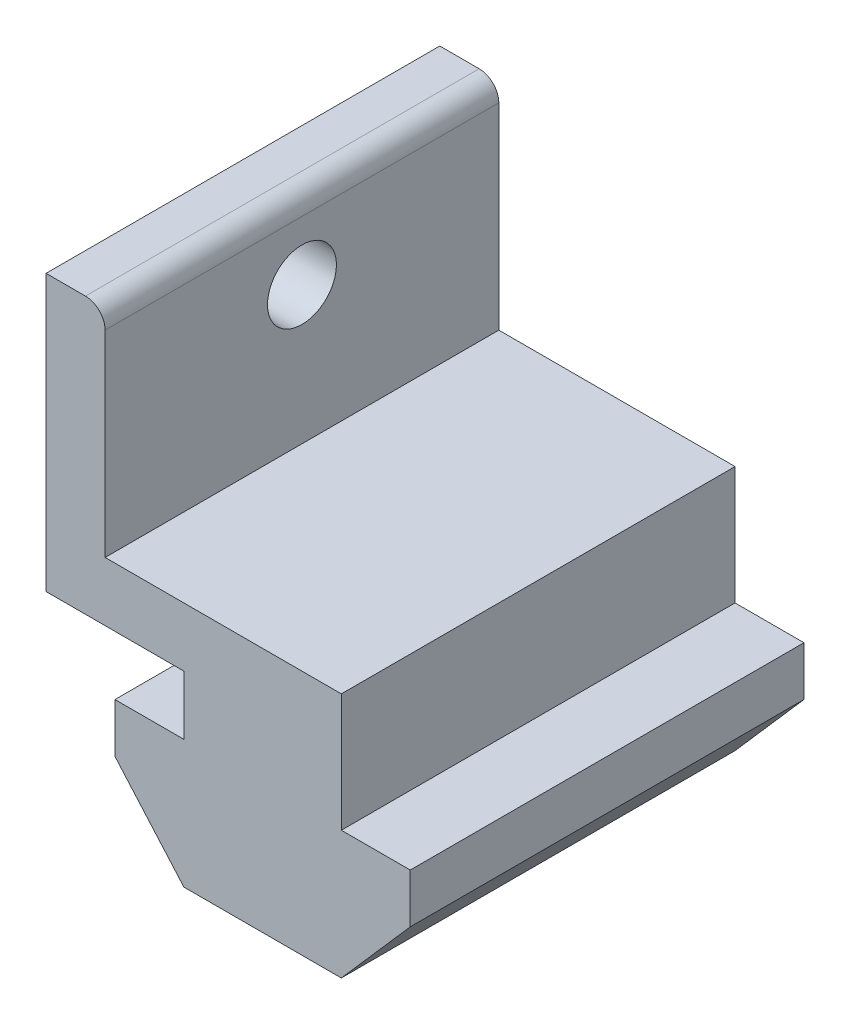
from build123d import *

# Parameters (mm, degrees)
ESTRUSIONE_ESTRUSIONE1_DEPTH = 20
TAGLIO_ESTRUSIONE1_REACH     = 37.979
SCHIZZO6_R                   = 1.75
ESTRUSIONE_ESTRUSIONE4_DEPTH = 0.6


with BuildPart() as part:
    # Schizzo2 → Estrusione-Estrusione1 (new body)
    with BuildSketch(Plane.XY):
        with BuildLine():
            Line((-4, 9.5), (-11, 9.5))
            Line((-11, 9.5), (-11, 23.5))
            Line((-11, 23.5), (-9, 23.5))
            ThreePointArc((-9, 23.5), (-8.292893219, 23.207106781), (-8, 22.5))
            Line((-8, 22.5), (-8, 12.5))
            Line((-8, 12.5), (4, 12.5))
            Line((4, 12.5), (4, 9.5))
            Line((4, 9.5), (4, 6.5))
            Line((4, 6.5), (7.5, 6.5))
            Line((7.5, 6.5), (7.5, 4))
            Line((7.5, 4), (4, 0))
            Line((4, 0), (-4, 0))
            Line((-4, 0), (-7.5, 4))
            Line((-7.5, 4), (-7.5, 6.5))
            Line((-7.5, 6.5), (-4, 6.5))
            Line((-4, 6.5), (-4, 9.5))
        make_face()
    extrude(amount=-ESTRUSIONE_ESTRUSIONE1_DEPTH)

    # Schizzo6 → Taglio-Estrusione1 (cut, up to next)
    with BuildSketch(Plane.ZY.offset(11), mode=Mode.PRIVATE) as taglio_estrusione1_sk1:
        with Locations((-10, 19.5)):
            Circle(SCHIZZO6_R)
    taglio_estrusione1_tool1 = extrude(taglio_estrusione1_sk1.sketch, amount=-TAGLIO_ESTRUSIONE1_REACH, mode=Mode.PRIVATE) & part.part
    add(taglio_estrusione1_tool1.solids().sort_by_distance((-11, 19.5, -10))[0], mode=Mode.SUBTRACT)

    # Schizzo11 → Estrusione-Estrusione4 (add)
    with BuildSketch(Plane(origin=(0, 0, -20), x_dir=(-1, 0, 0), z_dir=(0, 0, -1))):
        with BuildLine():
            Line((-1.916666667, 6), (-2.5, 6))
            add(Edge.make_bspline(
                [(-2.5, 6), (-2.484196549, 6.065431756), (-2.453302094, 6.193345487), (-2.388863743, 6.376101829), (-2.318665127, 6.549045511), (-2.234371075, 6.708938219), (-2.142426246, 6.858993324), (-2.037084049, 6.995807413), (-1.923204564, 7.122860063), (-1.797243944, 7.235613218), (-1.665147858, 7.337714716), (-1.525054993, 7.424768393), (-1.379783905, 7.499656106), (-1.228328086, 7.561350822), (-1.070236625, 7.607826795), (-0.906938753, 7.641546577), (-0.738006538, 7.66344436), (-0.623332441, 7.665581492), (-0.565104167, 7.666666667)],
                knots=[0, 0, 0, 0, 1.162005537, 2.271625781, 3.343758855, 4.383309926, 5.390229558, 6.379919256, 7.361854164, 8.333198761, 9.295911338, 10.242430842, 11.177959212, 12.116337295, 13.062827104, 14.020064771, 14.994644689, 16, 16, 16, 16], degree=3))
            add(Edge.make_bspline(
                [(-0.565104167, 7.666666667), (-0.480264789, 7.664105239), (-0.312436625, 7.659038256), (-0.065876681, 7.612768588), (0.171887412, 7.539550485), (0.398253158, 7.438384992), (0.608515961, 7.313608553), (0.795597451, 7.165102613), (0.956961828, 6.995732482), (1.092337101, 6.80865772), (1.198333527, 6.608726059), (1.276493935, 6.402954339), (1.324077057, 6.191830678), (1.330243806, 6.049281445), (1.333333333, 5.977864583)],
                knots=[0, 0, 0, 0, 1.083050992, 2.142477498, 3.193116406, 4.255571735, 5.30263384, 6.308962982, 7.297363603, 8.282367274, 9.249857812, 10.179914175, 11.08814088, 12, 12, 12, 12], degree=3))
            add(Edge.make_bspline(
                [(1.333333333, 5.977864583), (1.331172379, 5.909137679), (1.326943725, 5.774649792), (1.291038272, 5.578309869), (1.230613784, 5.393261183), (1.146912796, 5.218724739), (1.038564203, 5.055807179), (0.907314909, 4.904141953), (0.752238537, 4.763056374), (0.634720509, 4.682234495), (0.57421875, 4.640625)],
                knots=[0, 0, 0, 0, 1.024540389, 2.004866551, 2.965041327, 3.920577974, 4.882998113, 5.874504559, 6.905732034, 8, 8, 8, 8], degree=3))
            add(Edge.make_bspline(
                [(0.57421875, 4.640625), (0.643363437, 4.607236967), (0.780359061, 4.541085617), (0.967095758, 4.411353496), (1.136611813, 4.261563137), (1.231147291, 4.144669639), (1.278645833, 4.0859375)],
                knots=[0, 0, 0, 0, 1.015518401, 2.012035669, 3.001164323, 4, 4, 4, 4], degree=3))
            add(Edge.make_bspline(
                [(1.278645833, 4.0859375), (1.309922612, 4.043115961), (1.37196399, 3.958174116), (1.448544267, 3.821606468), (1.518018337, 3.683525131), (1.572154458, 3.540229091), (1.614077354, 3.393379209), (1.644044271, 3.24272333), (1.662660533, 3.088138431), (1.665326558, 2.983558111), (1.666666667, 2.930989583)],
                knots=[0, 0, 0, 0, 1.025084078, 2.033381695, 3.024893161, 4.013698104, 4.991890475, 5.976764909, 6.982997093, 8, 8, 8, 8], degree=3))
            add(Edge.make_bspline(
                [(1.666666667, 2.930989583), (1.663333999, 2.83997153), (1.656684346, 2.658363755), (1.597248208, 2.390053558), (1.505109333, 2.127777625), (1.374260737, 1.876924352), (1.214792507, 1.64221793), (1.025071762, 1.43221907), (0.807254146, 1.251707377), (0.56432937, 1.100888382), (0.301140417, 0.980326526), (0.019642889, 0.896648418), (-0.276107211, 0.842148704), (-0.478920764, 0.836304519), (-0.58203125, 0.833333333)],
                knots=[0, 0, 0, 0, 0.955779014, 1.907060117, 2.875433937, 3.871313158, 4.872415639, 5.851225146, 6.836215519, 7.83643374, 8.849228613, 9.86973379, 10.916971861, 12, 12, 12, 12], degree=3))
            add(Edge.make_bspline(
                [(-0.58203125, 0.833333333), (-0.651524236, 0.834945729), (-0.78826326, 0.838118387), (-0.9892869, 0.859807218), (-1.181170056, 0.899420085), (-1.364172166, 0.952726223), (-1.538455805, 1.020310887), (-1.703489143, 1.104474184), (-1.860287517, 1.203481259), (-2.007371283, 1.318500779), (-2.144722909, 1.447166124), (-2.268692254, 1.591761428), (-2.381346155, 1.74961375), (-2.479668199, 1.922556569), (-2.568136825, 2.108354904), (-2.640901459, 2.309387829), (-2.704946086, 2.523858156), (-2.73472252, 2.673316816), (-2.75, 2.75)],
                knots=[0, 0, 0, 0, 1.048658725, 2.063410685, 3.046034179, 4.001477787, 4.936774919, 5.862367409, 6.792675028, 7.730719943, 8.675894397, 9.627829632, 10.600096036, 11.597688215, 12.626045268, 13.701542398, 14.82072376, 16, 16, 16, 16], degree=3))
            Line((-2.75, 2.75), (-2.166666667, 2.75))
            add(Edge.make_bspline(
                [(-2.166666667, 2.75), (-2.151469125, 2.699951833), (-2.121908588, 2.602603799), (-2.071590606, 2.462500375), (-2.014263815, 2.33406399), (-1.952765349, 2.216352478), (-1.888176806, 2.108206588), (-1.815906231, 2.012485974), (-1.74130639, 1.924986312), (-1.685073305, 1.875689176), (-1.657552083, 1.8515625)],
                knots=[0, 0, 0, 0, 1.198163088, 2.33053128, 3.407730985, 4.417276592, 5.372219308, 6.28897303, 7.162600585, 8, 8, 8, 8], degree=3))
            add(Edge.make_bspline(
                [(-1.657552083, 1.8515625), (-1.621158441, 1.823504166), (-1.548483496, 1.767474107), (-1.430056781, 1.695971082), (-1.305507707, 1.634014892), (-1.172137598, 1.586688029), (-1.032824452, 1.54661523), (-0.885316488, 1.520391409), (-0.730915085, 1.502399091), (-0.625489239, 1.500811361), (-0.571614583, 1.5)],
                knots=[0, 0, 0, 0, 0.946170439, 1.889420265, 2.845303464, 3.807233317, 4.801018734, 5.828864929, 6.890507805, 8, 8, 8, 8], degree=3))
            add(Edge.make_bspline(
                [(-0.571614583, 1.5), (-0.51078665, 1.501143824), (-0.391842877, 1.503380473), (-0.218283853, 1.523949643), (-0.053170021, 1.553906125), (0.101665412, 1.600173093), (0.24825064, 1.657337532), (0.384530847, 1.729113142), (0.512295044, 1.813324768), (0.629906797, 1.909040348), (0.735662739, 2.013823125), (0.828778978, 2.123418828), (0.907939064, 2.237365369), (0.97179428, 2.356293307), (1.022216731, 2.479710161), (1.056542675, 2.607962273), (1.080409774, 2.740000053), (1.082353483, 2.829753852), (1.083333333, 2.875)],
                knots=[0, 0, 0, 0, 1.217147791, 2.380027433, 3.494444702, 4.572153297, 5.609568379, 6.639424714, 7.649109417, 8.668170816, 9.669597737, 10.625200337, 11.543417969, 12.441394052, 13.322311151, 14.205496177, 15.095365482, 16, 16, 16, 16], degree=3))
            add(Edge.make_bspline(
                [(1.083333333, 2.875), (1.080491345, 2.935563915), (1.074821509, 3.056390388), (1.031534147, 3.234151597), (0.960333399, 3.405423649), (0.860655878, 3.567284402), (0.739318097, 3.71729679), (0.597497555, 3.851143829), (0.43401656, 3.961588284), (0.283551089, 4.037895789), (0.150272941, 4.089964642), (0.036215798, 4.124646719), (-0.091475036, 4.154014937), (-0.231255399, 4.181337727), (-0.384178515, 4.204591659), (-0.5500779, 4.223983603), (-0.728987171, 4.239500107), (-0.852842194, 4.246429284), (-0.916666667, 4.25)],
                knots=[0, 0, 0, 0, 1.07054697, 2.135767047, 3.216561865, 4.33974944, 5.486079747, 6.621378074, 7.775625952, 8.963672916, 9.598146892, 10.304877434, 11.070270905, 11.915000392, 12.823868403, 13.805723172, 14.86925407, 16, 16, 16, 16], degree=3))
            Line((-0.916666667, 4.25), (-0.916666667, 4.916666667))
            add(Edge.make_bspline(
                [(-0.916666667, 4.916666667), (-0.836250216, 4.918031302), (-0.678734144, 4.920704288), (-0.448644721, 4.95303345), (-0.228622855, 4.997754616), (-0.02354462, 5.066255688), (0.163374419, 5.145816239), (0.325539394, 5.238398914), (0.460678382, 5.34131202), (0.568134658, 5.456144008), (0.648974654, 5.579300525), (0.708081563, 5.707660032), (0.742996455, 5.842347574), (0.747657265, 5.934266243), (0.75, 5.98046875)],
                knots=[0, 0, 0, 0, 1.321986639, 2.589447074, 3.816329219, 5.01088745, 6.139805852, 7.153945165, 8.075214402, 8.924034688, 9.728124013, 10.488707548, 11.240355623, 12, 12, 12, 12], degree=3))
            add(Edge.make_bspline(
                [(0.75, 5.98046875), (0.74923038, 6.014413134), (0.747699256, 6.081943876), (0.728390026, 6.180604717), (0.69937395, 6.276249331), (0.659483024, 6.368470979), (0.606089798, 6.456630059), (0.542192966, 6.541478178), (0.466109351, 6.622530911), (0.37892495, 6.698080076), (0.285303026, 6.770080088), (0.182696301, 6.831205413), (0.074198534, 6.883474814), (-0.040310397, 6.926578176), (-0.161202096, 6.959002568), (-0.28790856, 6.982283416), (-0.420671401, 6.996839061), (-0.511247475, 6.99893469), (-0.557291667, 7)],
                knots=[0, 0, 0, 0, 0.884392785, 1.759457502, 2.611959086, 3.489218968, 4.37281399, 5.2945488, 6.255912374, 7.266815255, 8.301784654, 9.332968512, 10.37626691, 11.440494194, 12.520033166, 13.637162961, 14.798855837, 16, 16, 16, 16], degree=3))
            add(Edge.make_bspline(
                [(-0.557291667, 7), (-0.631301907, 6.997416042), (-0.775861121, 6.992368971), (-0.984260252, 6.948163375), (-1.177996158, 6.877632648), (-1.326082253, 6.793442755), (-1.435435605, 6.710334806), (-1.51357849, 6.637753232), (-1.590316581, 6.557092273), (-1.660601409, 6.463383862), (-1.731681652, 6.362974109), (-1.79639298, 6.2507587), (-1.859275266, 6.129664825), (-1.897165715, 6.044058647), (-1.916666667, 6)],
                knots=[0, 0, 0, 0, 1.472543308, 2.876219568, 4.221790263, 5.565193594, 6.249813518, 6.953379497, 7.687249741, 8.463570142, 9.283606569, 10.136032583, 11.040678096, 12, 12, 12, 12], degree=3))
        make_face()
    extrude(amount=ESTRUSIONE_ESTRUSIONE4_DEPTH)


solid = part.part
